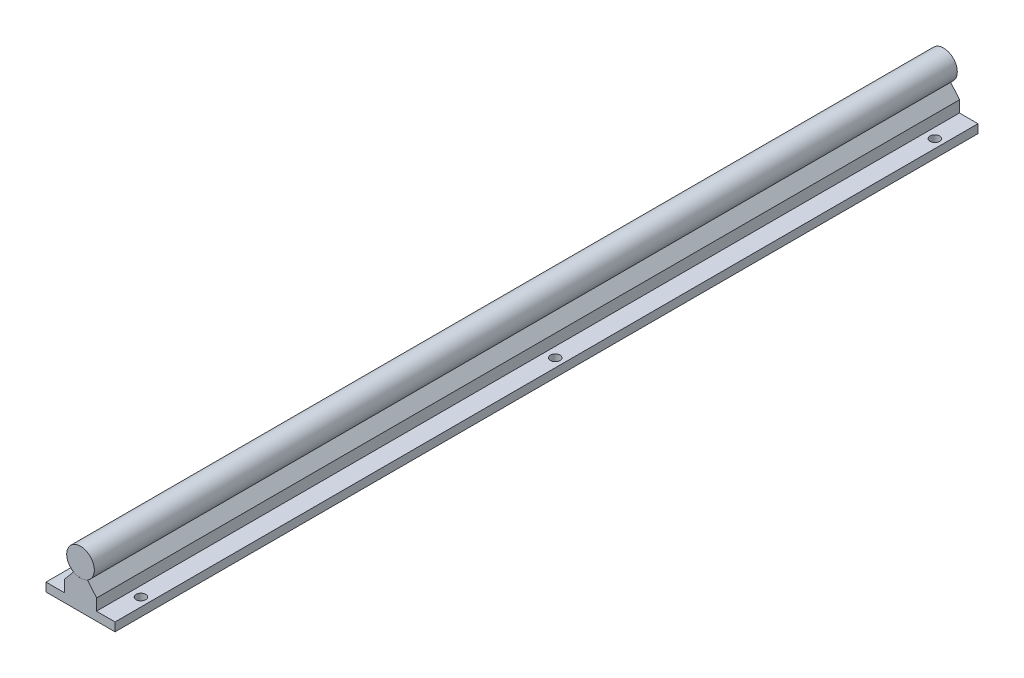
from build123d import *

# Parameters (mm, degrees)
SKETCH1_R          = 8
EXTRUDE1_DEPTH     = 500
EXTRUDE3_DEPTH     = 500
SKETCH8_R          = 2.75
CUT_EXTRUDE1_DEPTH = 5


with BuildPart() as part:
    # Sketch1 → Extrude1 (new body)
    with BuildSketch(Plane.XY):
        with Locations((0, -1.825456957)):
            Circle(SKETCH1_R)
    extrude(amount=EXTRUDE1_DEPTH)


with BuildPart() as body_2:
    # Sketch2 → Extrude3 (new body)
    with BuildSketch(Plane.XY):
        with BuildLine():
            Line((4, -8.753660187), (9.346572319, -15.125456957))
            Line((9.346572319, -15.125456957), (9.25, -15.125456957))
            Line((9.25, -15.125456957), (9.25, -21.825456957))
            Line((9.25, -21.825456957), (20, -21.825456957))
            Line((20, -21.825456957), (20, -26.825456957))
            Line((20, -26.825456957), (0, -26.825456957))
            Line((0, -26.825456957), (0, -9.825456957))
            ThreePointArc((0, -9.825456957), (2.070552361, -9.552863567), (4, -8.753660187))
        make_face()
    extrude(amount=EXTRUDE3_DEPTH)


with BuildPart() as body_3:
    # Mirror5: mirrored copy
    add(body_2.part.mirror(Plane(origin=(0, -26.825456957, 500), x_dir=(0, 0, 1), z_dir=(1, 0, 0))))

    # Combine1: union body 2
    add(body_2.part)

    # Sketch8 → Cut-Extrude1 (cut)
    with BuildSketch(Plane.XZ.offset(26.825456957)):
        with Locations((-15, 20)):
            Circle(SKETCH8_R)
        with Locations((15, 20)):
            Circle(SKETCH8_R)
        with Locations((-15, 239.937905992)):
            Circle(SKETCH8_R)
        with Locations((15, 239.937905992)):
            Circle(SKETCH8_R)
        with Locations((-15, 480)):
            Circle(SKETCH8_R)
        with Locations((15, 480)):
            Circle(SKETCH8_R)
    extrude(amount=-CUT_EXTRUDE1_DEPTH, mode=Mode.SUBTRACT)


solid = Compound([part.part, body_3.part])
